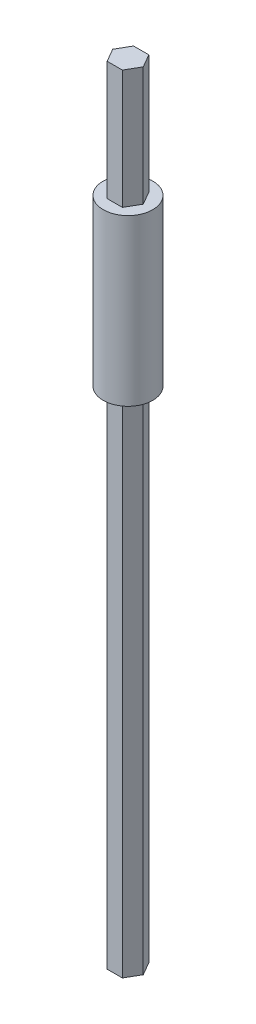
from build123d import *

# Parameters (mm, degrees)
CROQUIS2_R              = 3.75
SALIENTE_EXTRUIR2_DEPTH = 25
SALIENTE_EXTRUIR4_DEPTH = 18
SALIENTE_EXTRUIR5_DEPTH = 76


with BuildPart() as part:
    # Croquis2 → Saliente-Extruir2 (new body)
    with BuildSketch(Plane(origin=(0, 71.3, 0), x_dir=(1, 0, 0), z_dir=(0, 1, 0))):
        with Locations(Location((1.555634919, 1.555634919, 0), (0, 0, 270))):
            Circle(CROQUIS2_R)
    extrude(amount=SALIENTE_EXTRUIR2_DEPTH)

    # Croquis3 → Saliente-Extruir4 (add)
    with BuildSketch(Plane(origin=(0, 96.3, 0), x_dir=(1, 0, 0), z_dir=(0, 1, 0))):
        Polygon((3.865035995, 1.555634919), (2.710335457, 3.555634919), (0.40093438, 3.555634919), (-0.753766158, 1.555634919), (0.40093438, -0.444365081), (2.710335457, -0.444365081), align=None)
    extrude(amount=SALIENTE_EXTRUIR4_DEPTH)

    # Croquis4 → Saliente-Extruir5 (add)
    with BuildSketch(Plane.XZ.offset(-71.3)):
        Polygon((3.865035995, -1.555634919), (2.710335457, 0.444365081), (0.40093438, 0.444365081), (-0.753766158, -1.555634919), (0.40093438, -3.555634919), (2.710335457, -3.555634919), align=None)
    extrude(amount=SALIENTE_EXTRUIR5_DEPTH)


solid = part.part
